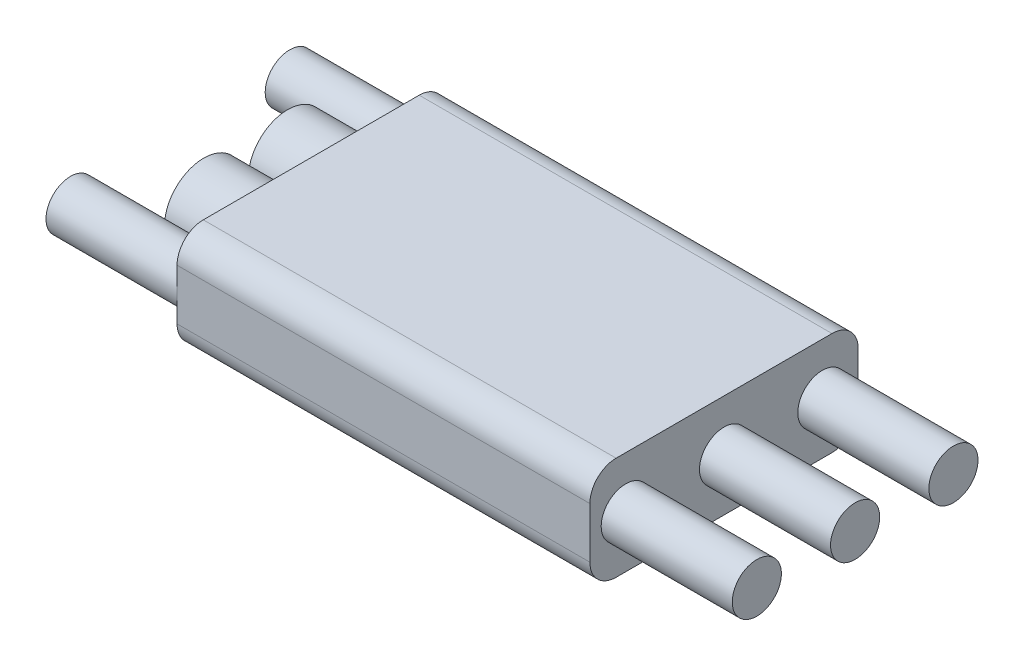
from build123d import *

# Parameters (mm, degrees)
SKETCH1_W             = 40
SKETCH1_H             = 26
ESC_BODY_DEPTH        = 5
SKETCH2_R             = 2.38125
MOTOR_WIRES_DEPTH     = 12.7
SKETCH3_R             = 3.81
CAPACITOR_HEADS_DEPTH = 6.35
SKETCH4_R             = 2.38125
POWER_WIRES_DEPTH     = 12.7
FILLET1_R             = 2.54


with BuildPart() as part:
    # Sketch1 → ESC Body (new, symmetric)
    with BuildSketch(Plane(origin=(0, 0, 0), x_dir=(1, 0, 0), z_dir=(0, 1, 0))):
        Rectangle(SKETCH1_W, SKETCH1_H)
    extrude(amount=ESC_BODY_DEPTH, both=True)

    # Sketch2 → Motor Wires (add)
    with BuildSketch(Plane(origin=(20, 0, 0), x_dir=(0, 0, -1), z_dir=(1, 0, 0))):
        with Locations(Location((0, 0, 0), (0, 0, 180))):
            Circle(SKETCH2_R)
        with Locations(Location((-9.525, 0, 0), (0, 0, 180))):
            Circle(SKETCH2_R)
        with Locations(Location((9.525, 0, 0), (0, 0, 180))):
            Circle(SKETCH2_R)
    extrude(amount=MOTOR_WIRES_DEPTH)

    # Sketch3 → Capacitor Heads (add)
    with BuildSketch(Plane.ZY.offset(20)):
        with Locations(Location((-4.064, 0, 0), (0, 0, 180))):
            Circle(SKETCH3_R)
        with Locations(Location((4.064, 0, 0), (0, 0, 180))):
            Circle(SKETCH3_R)
    extrude(amount=CAPACITOR_HEADS_DEPTH)

    # Sketch4 → Power Wires (add)
    with BuildSketch(Plane.ZY.offset(20)):
        with Locations(Location((-10.61875, 0, 0), (0, 0, 180))):
            Circle(SKETCH4_R)
        with Locations((10.61875, 0)):
            Circle(SKETCH4_R)
    extrude(amount=POWER_WIRES_DEPTH)

    # Fillet1
    fillet1_edges = [part.edges().sort_by_distance(p)[0] for p in [
        (0, 5, 13),
        (0, -5, 13),
        (0, -5, -13),
        (0, 5, -13),
    ]]
    fillet(fillet1_edges, radius=FILLET1_R)


solid = part.part
